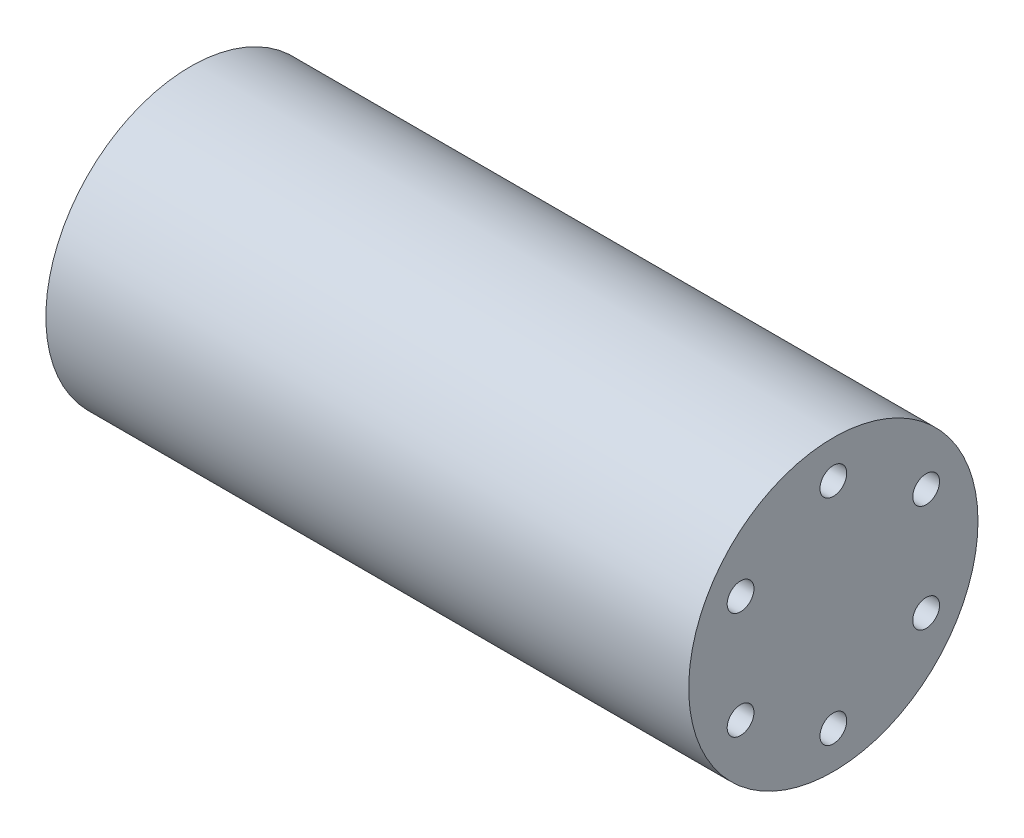
from build123d import *

# Parameters (mm, degrees)
SKETCH1_R           = 13.5
BOSS_EXTRUDE1_DEPTH = 30
SKETCH2_R           = 1.25
CUT_EXTRUDE1_DEPTH  = 4
SCALE1_SCALE        = 0.5


with BuildPart() as part:
    # Sketch1 → Boss-Extrude1 (new, symmetric)
    with BuildSketch(Plane(origin=(0, 0, 0), x_dir=(0, 0, -1), z_dir=(1, 0, 0))):
        Circle(SKETCH1_R)
    extrude(amount=BOSS_EXTRUDE1_DEPTH, both=True)

    # Sketch2 → Cut-Extrude1 (cut)
    with BuildSketch(Plane.ZY.offset(30)):
        with Locations((0, 10)):
            Circle(SKETCH2_R)
        with Locations((8.660254038, 5)):
            Circle(SKETCH2_R)
        with Locations((8.660254038, -5)):
            Circle(SKETCH2_R)
        with Locations((0, -10)):
            Circle(SKETCH2_R)
        with Locations((-8.660254038, -5)):
            Circle(SKETCH2_R)
        with Locations((-8.660254038, 5)):
            Circle(SKETCH2_R)
    cut_extrude1 = extrude(amount=-CUT_EXTRUDE1_DEPTH, mode=Mode.SUBTRACT)

    # Mirror1: Cut-Extrude1 across plane
    add(cut_extrude1.mirror(Plane(origin=(0, 0, 0), x_dir=(0, 0, 1), z_dir=(1, 0, 0))), mode=Mode.SUBTRACT)


with BuildPart() as part_1:
    # Scale1: scaled about (0, 0, 0)
    add(part.part.scale(SCALE1_SCALE))


solid = part_1.part
